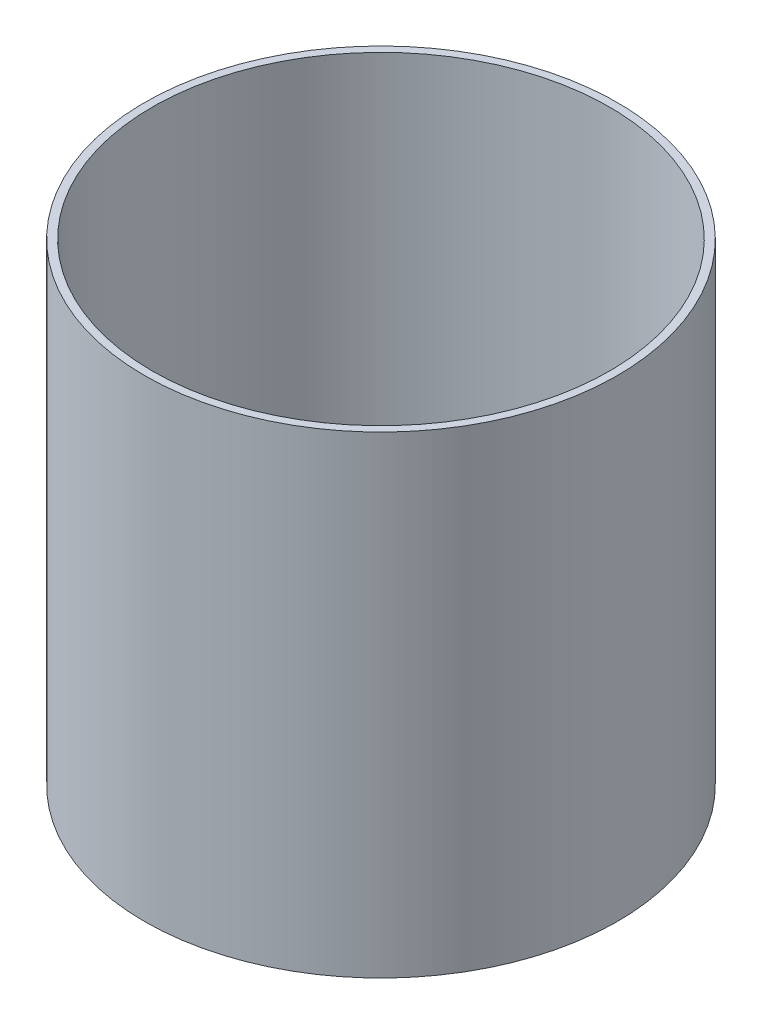
from build123d import *

# Parameters (mm, degrees)
SKETCH1_R           = 76
SKETCH1_R_2         = 73.5
BOSS_EXTRUDE1_DEPTH = 152


with BuildPart() as part:
    # Sketch1 → Boss-Extrude1 (new body)
    with BuildSketch(Plane(origin=(0, 0, 0), x_dir=(1, 0, 0), z_dir=(0, 1, 0))):
        with Locations(Location((0, 0, 0), (0, 0, 270))):
            Circle(SKETCH1_R)
        with Locations(Location((0, 0, 0), (0, 0, 270))):
            Circle(SKETCH1_R_2, mode=Mode.SUBTRACT)
    extrude(amount=BOSS_EXTRUDE1_DEPTH)


solid = part.part
